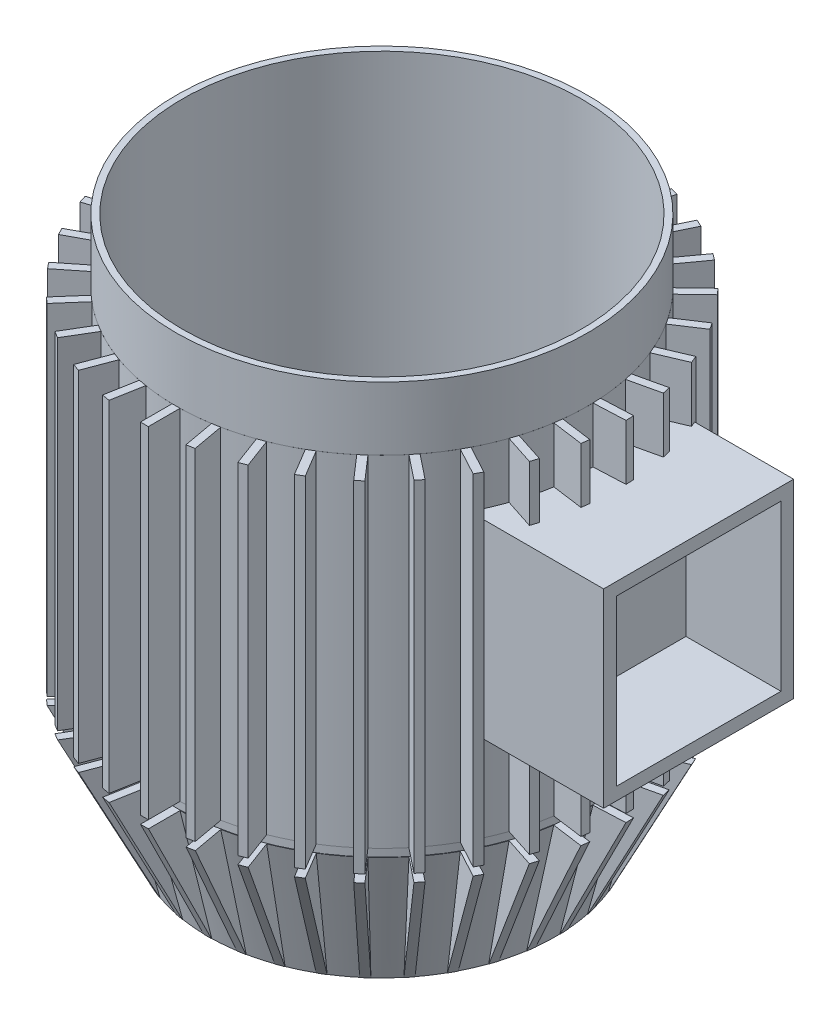
from build123d import *

# Parameters (mm, degrees)
SKETCH1_R           = 1651
BOSS_EXTRUDE1_DEPTH = 4318
CHAMFER1_SIZE       = 254
CHAMFER1_SIZE2      = 1016
SHELL1_T            = -50.8
BOSS_EXTRUDE2_REACH = 5834.329
SKETCH2_W           = 63.5
SKETCH2_H           = 4318
CIRPATTERN1_COUNT   = 35
SKETCH4_R           = 254
CUT_EXTRUDE1_DEPTH  = 5090.331297603
BOSS_EXTRUDE3_REACH = 6484.884
SKETCH6_W           = 1524
SKETCH6_H           = 1524
SKETCH7_W           = 1320.8
SKETCH7_H           = 1320.8
CUT_EXTRUDE3_DEPTH  = 762
SKETCH8_W           = 493.645068523
SKETCH8_H           = 508
SCALE1_SCALE        = 0.02


with BuildPart() as part:
    # Sketch1 → Boss-Extrude1 (new body)
    with BuildSketch(Plane(origin=(0, 0, 0), x_dir=(1, 0, 0), z_dir=(0, 1, 0))):
        with Locations(Location((0, 0, 0), (0, 0, 270))):
            Circle(SKETCH1_R)
    extrude(amount=-BOSS_EXTRUDE1_DEPTH)

    # Chamfer1
    chamfer1_edges = [part.edges().sort_by_distance(p)[0] for p in [
        (0, -4318, -1651),
    ]]
    chamfer1_side = [part.faces().sort_by_distance(p)[0] for p in [
        (0, -4318, 0),
    ]]
    chamfer(chamfer1_edges, length=CHAMFER1_SIZE, length2=CHAMFER1_SIZE2, reference=chamfer1_side[0])

    # Shell1
    shell1_openings = [part.faces().sort_by_distance(p)[0] for p in [
        (0, 0, 0),
    ]]
    offset(amount=SHELL1_T, openings=shell1_openings, kind=Kind.INTERSECTION)

    # Sketch2 → Boss-Extrude2 (add, up to next)
    with BuildSketch(Plane.XY.offset(1905), mode=Mode.PRIVATE) as boss_extrude2_sk1:
        with Locations((0, -2159)):
            Rectangle(SKETCH2_W, SKETCH2_H)
    boss_extrude2_tool1 = extrude(boss_extrude2_sk1.sketch, amount=-BOSS_EXTRUDE2_REACH, mode=Mode.PRIVATE) - part.part
    boss_extrude2 = boss_extrude2_tool1.solids().sort_by_distance((0, -2159, 1905))[0]
    add(boss_extrude2)

    # CirPattern1: Boss-Extrude2 ×35 about axis
    cirpattern1_axis = Axis((0, 0, 0), (0, 1, 0))
    for i in range(1, CIRPATTERN1_COUNT):
        add(boss_extrude2.rotate(cirpattern1_axis, i * 360 / CIRPATTERN1_COUNT))

    # Sketch3 → Cut-Revolve1 (revolve, cut)
    with BuildSketch(Plane.XY, mode=Mode.PRIVATE) as cut_revolve1_sk:
        Polygon((-1398.865454697, -4318), (-1904.506250125, -3302), (-1647.608085237, -3302), (-1647.608085237, -3238.5), (-2052.186441023, -3238.5), (-2052.186441023, -4573.4164032), align=None)
    revolve(cut_revolve1_sk.sketch.rotate(Axis((0, 0, 0), (0, -1, 0)), 270), axis=Axis((0, 0, 0), (0, -1, 0)), mode=Mode.SUBTRACT)

    # Sketch4 → Cut-Extrude1 (cut, through all)
    with BuildSketch(Plane.XZ.offset(4318)):
        with Locations(Location((0, 0, 0), (0, 0, 270))):
            Circle(SKETCH4_R)
    extrude(amount=-CUT_EXTRUDE1_DEPTH, mode=Mode.SUBTRACT)

    # Sketch6 → Boss-Extrude3 (add, up to next)
    with BuildSketch(Plane(origin=(2540, 0, 0), x_dir=(0, 0, -1), z_dir=(1, 0, 0)), mode=Mode.PRIVATE) as boss_extrude3_sk1:
        with Locations((0, -1714.5)):
            Rectangle(SKETCH6_W, SKETCH6_H)
    boss_extrude3_tool1 = extrude(boss_extrude3_sk1.sketch, amount=-BOSS_EXTRUDE3_REACH, mode=Mode.PRIVATE) - part.part
    add(boss_extrude3_tool1.solids().sort_by_distance((2540, -1714.5, 0))[0])

    # Sketch7 → Cut-Extrude3 (cut)
    with BuildSketch(Plane(origin=(2540, 0, 0), x_dir=(0, 0, -1), z_dir=(1, 0, 0))):
        with Locations((0, -1714.5)):
            Rectangle(SKETCH7_W, SKETCH7_H)
    extrude(amount=-CUT_EXTRUDE3_DEPTH, mode=Mode.SUBTRACT)

    # Sketch8 → Cut-Revolve2 (revolve, cut)
    with BuildSketch(Plane(origin=(0, 0, 0), x_dir=(0, 0, -1), z_dir=(1, 0, 0))):
        with Locations((-1897.51721757, -254)):
            Rectangle(SKETCH8_W, SKETCH8_H)
    revolve(axis=Axis((0, 0, 0), (0, -1, 0)), mode=Mode.SUBTRACT)


with BuildPart() as part_1:
    # Scale1: scaled about (286.010032781, -2200.142581701, 3.975067399)
    add(part.part.scale(SCALE1_SCALE).moved(Location((280.289832125, -2156.139730067, 3.895566051))))


solid = part_1.part
